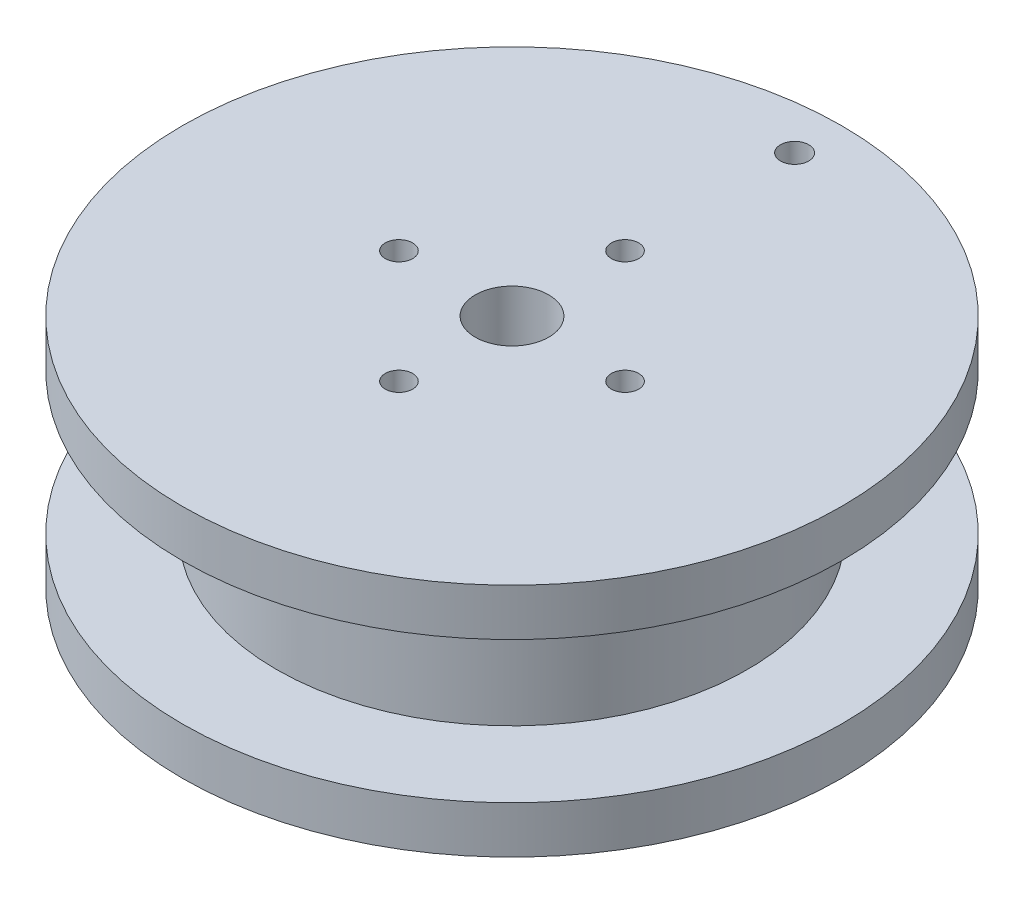
from build123d import *

# Parameters (mm, degrees)
SKETCH1_W          = 25
SKETCH1_H          = 15
SKETCH2_R          = 3.9
SKETCH2_R_2        = 1.45
CUT_EXTRUDE1_DEPTH = 53
SKETCH3_R          = 1.5
CUT_EXTRUDE2_DEPTH = 53


with BuildPart() as part:
    # Sketch1 → Revolve1 (revolve)
    with BuildSketch(Plane(origin=(0, 0, 0), x_dir=(0, 0, -1), z_dir=(1, 0, 0))):
        Polygon((0, 20), (0, 15), (25, 15), (35, 15), (35, 20), align=None)
        with Locations((12.5, 7.5)):
            Rectangle(SKETCH1_W, SKETCH1_H)
        Polygon((25, 0), (0, 0), (0, -5), (35, -5), (35, 0), align=None)
    revolve(axis=Axis((0, 0, 0), (0, 1, 0)))

    # Sketch2 → Cut-Extrude1 (cut)
    with BuildSketch(Plane(origin=(0, 20, 0), x_dir=(1, 0, 0), z_dir=(0, 1, 0))):
        with Locations(Location((0, 0, 0), (0, 0, 270))):
            Circle(SKETCH2_R)
        with Locations(Location((0, 12, 0), (0, 0, 270))):
            Circle(SKETCH2_R_2)
        with Locations(Location((12, 0, 0), (0, 0, 270))):
            Circle(SKETCH2_R_2)
        with Locations(Location((0, -12, 0), (0, 0, 270))):
            Circle(SKETCH2_R_2)
        with Locations(Location((-12, 0, 0), (0, 0, 270))):
            Circle(SKETCH2_R_2)
    extrude(amount=-CUT_EXTRUDE1_DEPTH, mode=Mode.SUBTRACT)

    # Sketch3 → Cut-Extrude2 (cut)
    with BuildSketch(Plane(origin=(0, 20, 0), x_dir=(1, 0, 0), z_dir=(0, 1, 0))):
        with Locations(Location((0, 30, 0), (0, 0, 90))):
            Circle(SKETCH3_R)
    extrude(amount=-CUT_EXTRUDE2_DEPTH, mode=Mode.SUBTRACT)


solid = part.part
